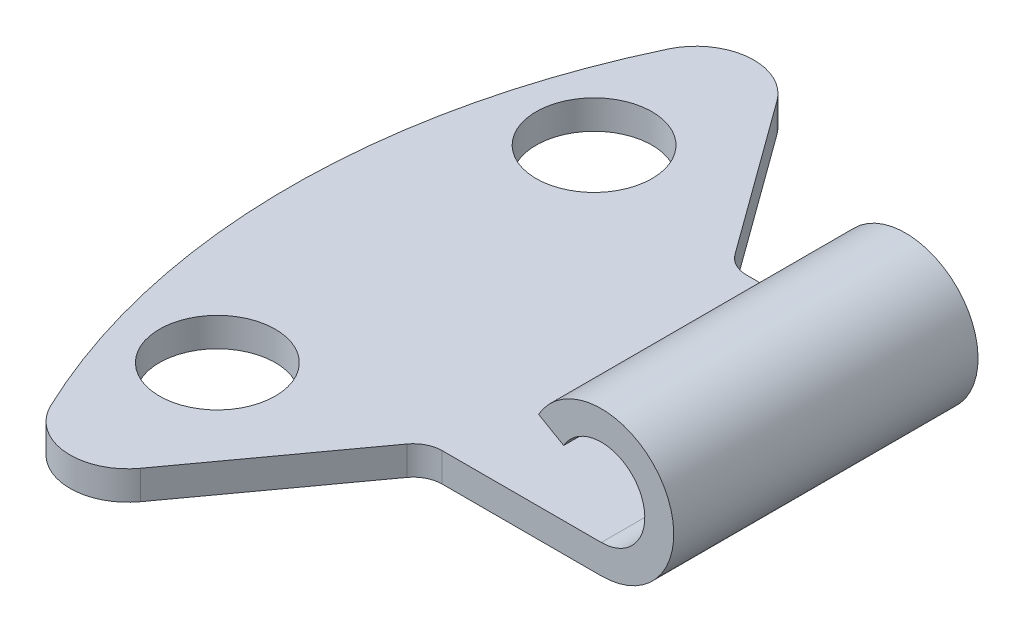
from build123d import *

# Parameters (mm, degrees)
ESTRUSIONE_ESTRUSIONE1_DEPTH  = 27
TAGLIO_ESTRUSIONE1_DEPTH      = 27
TAGLIO_ESTRUSIONE1_DEPTH_BACK = 27
SCHIZZO2_R                    = 2


with BuildPart() as part:
    # Schizzo1 → Estrusione-Estrusione1 (new body)
    with BuildSketch(Plane.XY):
        with BuildLine():
            Line((-8, 1), (8, 1))
            ThreePointArc((8, 1), (9.299038106, 3.25), (6.700961894, 3.25))
            Line((6.700961894, 3.25), (5.834936491, 3.75))
            ThreePointArc((5.834936491, 3.75), (10.165063509, 3.75), (8, 0))
            Line((8, 0), (-8, 0))
            Line((-8, 0), (-8, 1))
        make_face()
    extrude(amount=ESTRUSIONE_ESTRUSIONE1_DEPTH)

    # Schizzo2 → Taglio-Estrusione1 (cut, two sides: drawn at the far end of the back side and taken through both)
    with BuildSketch(Plane(origin=(0, 1, 0), x_dir=(1, 0, 0), z_dir=(0, 1, 0)).offset(-TAGLIO_ESTRUSIONE1_DEPTH_BACK)):
        with BuildLine():
            Line((12, -8.25), (12, 0))
            Line((12, 0), (-8, 0))
            Line((-8, 0), (-8, -13.5))
            ThreePointArc((-8, -13.5), (-7.389705753, -8.034174396), (-5.588882762, -2.837565391))
            ThreePointArc((-5.588882762, -2.837565391), (-3.967228406, -1.706548983), (-2.166002653, -2.521746353))
            Line((-2.166002653, -2.521746353), (1.700488507, -7.838171698))
            ThreePointArc((1.700488507, -7.838171698), (2.055446947, -8.141114947), (2.509224592, -8.25))
            Line((2.509224592, -8.25), (12, -8.25))
        make_face()
        with BuildLine():
            Line((-8, -27), (12, -27))
            Line((12, -27), (12, -18.75))
            Line((12, -18.75), (2.509224592, -18.75))
            ThreePointArc((2.509224592, -18.75), (2.055446947, -18.858885053), (1.700488507, -19.161828302))
            Line((1.700488507, -19.161828302), (-2.166002653, -24.478253647))
            ThreePointArc((-2.166002653, -24.478253647), (-3.967228406, -25.293451017), (-5.588882762, -24.162434609))
            ThreePointArc((-5.588882762, -24.162434609), (-7.389705753, -18.965825604), (-8, -13.5))
            Line((-8, -13.5), (-8, -27))
        make_face()
        with Locations((-4, -7)):
            Circle(SCHIZZO2_R)
        with Locations((-4, -20)):
            Circle(SCHIZZO2_R)
    extrude(amount=TAGLIO_ESTRUSIONE1_DEPTH + TAGLIO_ESTRUSIONE1_DEPTH_BACK, mode=Mode.SUBTRACT)


solid = part.part
